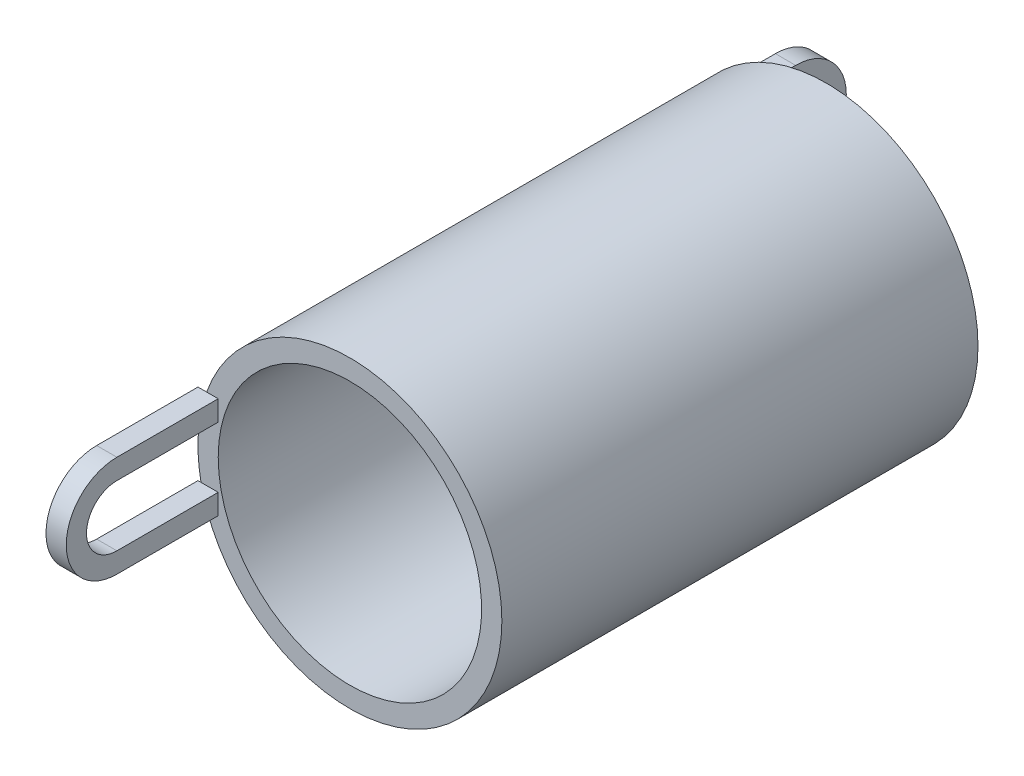
from build123d import *

# Parameters (mm, degrees)
ESBO_O2_R                = 7.5
ESBO_O2_R_2              = 6.5
RESSALTO_EXTRUS_O1_DEPTH = 23.5
RESSALTO_EXTRUS_O2_DEPTH = 1


with BuildPart() as part:
    # Esboço2 → Ressalto-extrusão1 (new body)
    with BuildSketch(Plane.XY):
        Circle(ESBO_O2_R)
        Circle(ESBO_O2_R_2, mode=Mode.SUBTRACT)
    extrude(amount=RESSALTO_EXTRUS_O1_DEPTH)

    # Esboço3 → Ressalto-extrusão2 (add)
    with BuildSketch(Plane(origin=(-7.5, 0, 0), x_dir=(0, 0, -1), z_dir=(1, 0, 0))):
        with BuildLine():
            Line((5, 1.5), (0, 1.5))
            Line((0, 1.5), (0, 2.5))
            Line((0, 2.5), (5, 2.5))
            ThreePointArc((5, 2.5), (7.5, 0), (5, -2.5))
            Line((5, -2.5), (0, -2.5))
            Line((0, -2.5), (0, -1.5))
            Line((0, -1.5), (5, -1.5))
            ThreePointArc((5, -1.5), (6.5, 0), (5, 1.5))
        make_face()
        with BuildLine():
            Line((-28.5, 2.5), (-23.5, 2.5))
            Line((-23.5, 2.5), (-23.5, 1.5))
            Line((-23.5, 1.5), (-28.5, 1.5))
            ThreePointArc((-28.5, 1.5), (-30, 0), (-28.5, -1.5))
            Line((-28.5, -1.5), (-23.5, -1.5))
            Line((-23.5, -1.5), (-23.5, -2.5))
            Line((-23.5, -2.5), (-28.5, -2.5))
            ThreePointArc((-28.5, -2.5), (-31, 0), (-28.5, 2.5))
        make_face()
    extrude(amount=RESSALTO_EXTRUS_O2_DEPTH)


solid = part.part
